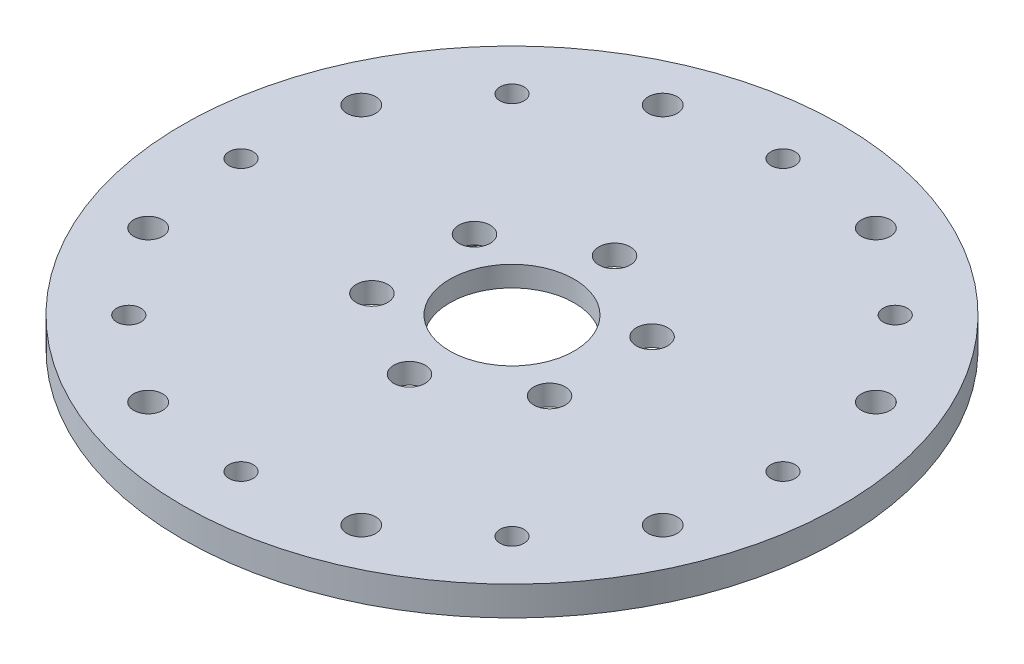
from build123d import *

# Parameters (mm, degrees)
SKETCH_1_R               = 45
EXTRUDE_1_DEPTH          = 4
SKETCH_2_R               = 2.15
CUT_EXTRUDE_1_DEPTH      = 64.765194268
PATTERN_CIRCULAR_1_COUNT = 6
CUT_EXTRUDE_2_DEPTH      = 64.765194268
CUT_EXTRUDE_2_DEPTH_BACK = 64.765194268
SKETCH_3_R               = 8.5
SKETCH_4_R               = 1.65
CUT_EXTRUDE_3_DEPTH      = 64.765194268
PATTERN_CIRCULAR_2_COUNT = 8
SKETCH_5_R               = 17.6
CUT_EXTRUDE_4_DEPTH      = 1.2
SKETCH_6_R               = 1.975
CUT_EXTRUDE_5_DEPTH      = 64.765194268
PATTERN_CIRCULAR_3_COUNT = 8


with BuildPart() as part:
    # 草图1 → 凸台-拉伸1 (new body)
    with BuildSketch(Plane(origin=(0, 0, 0), x_dir=(1, 0, 0), z_dir=(0, 1, 0))):
        with Locations(Location((0, 0, 0), (0, 0, 270))):
            Circle(SKETCH_1_R)
    extrude(amount=EXTRUDE_1_DEPTH)

    # 草图2 → 切除-拉伸1 (cut, symmetric)
    with BuildSketch(Plane(origin=(0, 4, 0), x_dir=(1, 0, 0), z_dir=(0, 1, 0))):
        with Locations(Location((0, 14, 0), (0, 0, 270))):
            Circle(SKETCH_2_R)
    cut_extrude_1 = extrude(amount=CUT_EXTRUDE_1_DEPTH, both=True, mode=Mode.SUBTRACT)

    # 阵列(圆周)1: 切除-拉伸1 ×6 about axis
    pattern_circular_1_axis = Axis((0, 0, 0), (0, 1, 0))
    for i in range(1, PATTERN_CIRCULAR_1_COUNT):
        add(cut_extrude_1.rotate(pattern_circular_1_axis, i * 360 / PATTERN_CIRCULAR_1_COUNT), mode=Mode.SUBTRACT)

    # 草图3 → 切除-拉伸2 (cut, two sides: drawn at the far end of the back side and taken through both)
    with BuildSketch(Plane(origin=(0, 4, 0), x_dir=(1, 0, 0), z_dir=(0, 1, 0)).offset(-CUT_EXTRUDE_2_DEPTH_BACK)):
        with Locations(Location((0, 0, 0), (0, 0, 270))):
            Circle(SKETCH_3_R)
    extrude(amount=CUT_EXTRUDE_2_DEPTH + CUT_EXTRUDE_2_DEPTH_BACK, mode=Mode.SUBTRACT)

    # 草图4 → 切除-拉伸3 (cut, symmetric)
    with BuildSketch(Plane(origin=(0, 4, 0), x_dir=(1, 0, 0), z_dir=(0, 1, 0))):
        with Locations(Location((0, 37, 0), (0, 0, 270))):
            Circle(SKETCH_4_R)
    cut_extrude_3 = extrude(amount=CUT_EXTRUDE_3_DEPTH, both=True, mode=Mode.SUBTRACT)

    # 阵列(圆周)2: 切除-拉伸3 ×8 about axis
    pattern_circular_2_axis = Axis((0, 0, 0), (0, 1, 0))
    for i in range(1, PATTERN_CIRCULAR_2_COUNT):
        add(cut_extrude_3.rotate(pattern_circular_2_axis, i * 360 / PATTERN_CIRCULAR_2_COUNT), mode=Mode.SUBTRACT)

    # 草图5 → 切除-拉伸4 (cut)
    with BuildSketch(Plane.XZ):
        with Locations(Location((0, 0, 0), (0, 0, 270))):
            Circle(SKETCH_5_R)
    extrude(amount=-CUT_EXTRUDE_4_DEPTH, mode=Mode.SUBTRACT)

    # 草图6 → 切除-拉伸5 (cut, symmetric)
    with BuildSketch(Plane(origin=(0, 4, 0), x_dir=(1, 0, 0), z_dir=(0, 1, 0))):
        with Locations(Location((14.551537516, -35.130519224, 0), (0, 0, 270))):
            Circle(SKETCH_6_R)
    cut_extrude_5 = extrude(amount=CUT_EXTRUDE_5_DEPTH, both=True, mode=Mode.SUBTRACT)

    # 阵列(圆周)3: 切除-拉伸5 ×8 about axis
    pattern_circular_3_axis = Axis((0, 0, 0), (0, 1, 0))
    for i in range(1, PATTERN_CIRCULAR_3_COUNT):
        add(cut_extrude_5.rotate(pattern_circular_3_axis, i * 360 / PATTERN_CIRCULAR_3_COUNT), mode=Mode.SUBTRACT)


solid = part.part
